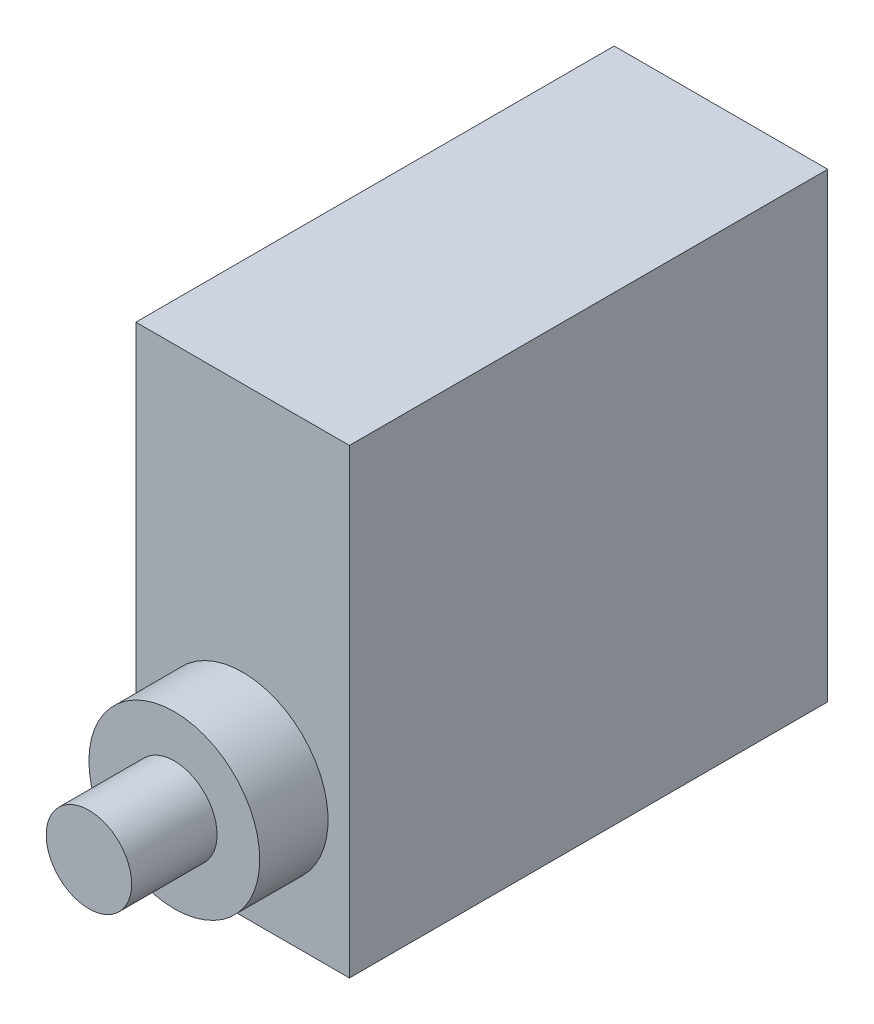
from build123d import *

# Parameters (mm, degrees)
SKETCH2_W           = 12.5
SKETCH2_H           = 27
BOSS_EXTRUDE1_DEPTH = 28
SKETCH3_R           = 5
BOSS_EXTRUDE2_DEPTH = 4
SKETCH4_R           = 2.5
BOSS_EXTRUDE3_DEPTH = 5


with BuildPart() as part:
    # Sketch2 → Boss-Extrude1 (new body)
    with BuildSketch(Plane.XY):
        with Locations((6.25, 13.5)):
            Rectangle(SKETCH2_W, SKETCH2_H)
    extrude(amount=BOSS_EXTRUDE1_DEPTH)

    # Sketch3 → Boss-Extrude2 (add)
    with BuildSketch(Plane.XY.offset(28)):
        with Locations(Location((6.25, 7.381333163, 0), (0, 0, 180))):
            Circle(SKETCH3_R)
    extrude(amount=BOSS_EXTRUDE2_DEPTH)

    # Sketch4 → Boss-Extrude3 (add)
    with BuildSketch(Plane.XY.offset(32)):
        with Locations((6.25, 7.381333163)):
            Circle(SKETCH4_R)
    extrude(amount=BOSS_EXTRUDE3_DEPTH)


solid = part.part
